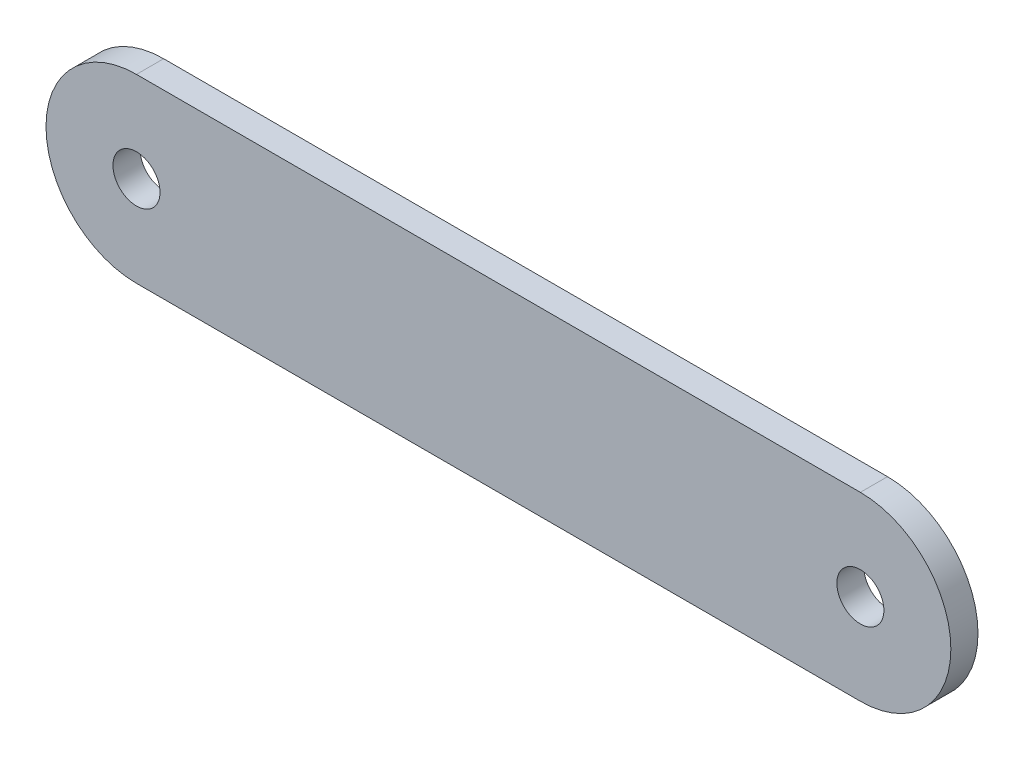
from build123d import *

# Parameters (mm, degrees)
SKETCH_1_R      = 2.6
EXTRUDE_1_DEPTH = 3


with BuildPart() as part:
    # 草图1 → 凸台-拉伸1 (new body)
    with BuildSketch(Plane.XY):
        with BuildLine():
            Line((-40, 10), (40, 10))
            ThreePointArc((40, 10), (50, 0), (40, -10))
            Line((40, -10), (-40, -10))
            ThreePointArc((-40, -10), (-50, 0), (-40, 10))
        make_face()
        with Locations((-40, 0)):
            Circle(SKETCH_1_R, mode=Mode.SUBTRACT)
        with Locations(Location((40, 0, 0), (0, 0, 180))):
            Circle(SKETCH_1_R, mode=Mode.SUBTRACT)
    extrude(amount=EXTRUDE_1_DEPTH)


solid = part.part
